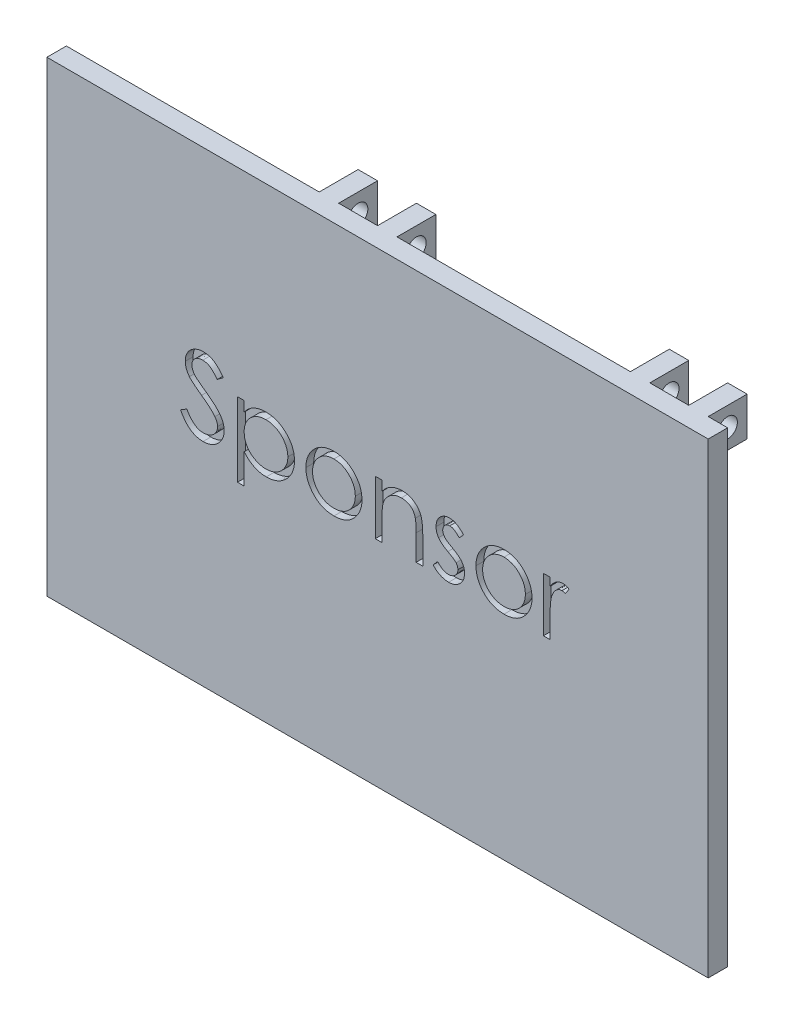
from build123d import *

# Parameters (mm, degrees)
ESQUISSE1_W             = 170
ESQUISSE1_H             = 120
BASE_DEPTH              = 5
ESQUISSE2_W             = 5
ESQUISSE2_H             = 10
BOSS_TIGE_DEPTH         = 10
VIDE_SPONSOR_DEPTH      = 2
ESQUISSE5_R             = 2.5
ENL_V_MAT_EXTRU_3_DEPTH = 176.855054079


with BuildPart() as part:
    # Esquisse1 → BASE (new body)
    with BuildSketch(Plane.XY):
        Rectangle(ESQUISSE1_W, ESQUISSE1_H)
    extrude(amount=BASE_DEPTH)

    # Esquisse2 → BOSS TIGE (add)
    with BuildSketch(Plane(origin=(0, 60, 0), x_dir=(1, 0, 0), z_dir=(0, 1, 0))):
        with Locations((77.5, 5)):
            Rectangle(ESQUISSE2_W, ESQUISSE2_H)
        with Locations((62.5, 5)):
            Rectangle(ESQUISSE2_W, ESQUISSE2_H)
        with Locations((-2.5, 5)):
            Rectangle(ESQUISSE2_W, ESQUISSE2_H)
        with Locations((-17.5, 5)):
            Rectangle(ESQUISSE2_W, ESQUISSE2_H)
    extrude(amount=-BOSS_TIGE_DEPTH)

    # Esquisse4 → VIDE SPONSOR (cut)
    # profile 1 of 7: a face of its own
    with BuildSketch(Plane.XY.offset(5)):
        with BuildLine():
            Line((-50.657804234, -1.320890287), (-49.0474076, -0.355415527))
            add(Edge.make_bspline(
                [(-49.0474076, -0.355415527), (-48.897629765, -0.606137394), (-48.610661215, -1.086510815), (-48.131954532, -1.735615292), (-47.635931115, -2.287315031), (-47.118917743, -2.738400566), (-46.584070225, -3.093540935), (-46.027897018, -3.345013082), (-45.452272363, -3.50185432), (-45.060529134, -3.520904791), (-44.864955676, -3.530415527)],
                knots=[0, 0, 0, 0, 1.272034388, 2.437168799, 3.508375237, 4.49857839, 5.41946034, 6.295179144, 7.148887113, 8, 8, 8, 8], degree=3))
            add(Edge.make_bspline(
                [(-44.864955676, -3.530415527), (-44.697931479, -3.525763667), (-44.366805614, -3.516541342), (-43.87933112, -3.427927263), (-43.405901596, -3.291789818), (-42.956274582, -3.096821605), (-42.536654166, -2.860936419), (-42.168680581, -2.576023653), (-41.850566737, -2.257038447), (-41.590348556, -1.901169998), (-41.390704364, -1.518443804), (-41.237258963, -1.125600411), (-41.152105062, -0.716468633), (-41.13927759, -0.441003113), (-41.132804234, -0.301990046)],
                knots=[0, 0, 0, 0, 1.095163259, 2.171163733, 3.241058638, 4.321873601, 5.38011039, 6.391990106, 7.366004449, 8.327778327, 9.272591725, 10.192022065, 11.087607919, 12, 12, 12, 12], degree=3))
            add(Edge.make_bspline(
                [(-41.132804234, -0.301990046), (-41.140828697, -0.143380564), (-41.157141256, 0.179049335), (-41.295016884, 0.654753161), (-41.511910641, 1.125519863), (-41.712004459, 1.416719609), (-41.815887167, 1.567901781)],
                knots=[0, 0, 0, 0, 0.938893495, 1.908633276, 2.914225137, 4, 4, 4, 4], degree=3))
            add(Edge.make_bspline(
                [(-41.815887167, 1.567901781), (-41.901180081, 1.677013778), (-42.080241886, 1.906080767), (-42.388076347, 2.247049834), (-42.749297626, 2.598758658), (-43.151544118, 2.974637239), (-43.609468502, 3.357203675), (-44.108728259, 3.764701017), (-44.66207012, 4.181632457), (-45.050143094, 4.461245993), (-45.250382359, 4.605521973)],
                knots=[0, 0, 0, 0, 0.722233717, 1.516239348, 2.393582979, 3.351407094, 4.387010283, 5.505090956, 6.712668013, 8, 8, 8, 8], degree=3))
            add(Edge.make_bspline(
                [(-45.250382359, 4.605521973), (-45.45081011, 4.748280428), (-45.834012707, 5.021223724), (-46.369908705, 5.42630447), (-46.849122139, 5.796657532), (-47.269523072, 6.135769369), (-47.630926592, 6.443685975), (-47.936180586, 6.717450472), (-48.177509018, 6.96446671), (-48.311705822, 7.124711728), (-48.371956878, 7.19665779)],
                knots=[0, 0, 0, 0, 1.452282411, 2.77665338, 3.964542531, 5.026858415, 5.96415736, 6.766646006, 7.446254459, 8, 8, 8, 8], degree=3))
            add(Edge.make_bspline(
                [(-48.371956878, 7.19665779), (-48.456171732, 7.308786291), (-48.621791543, 7.529302036), (-48.840409373, 7.87397019), (-49.026223959, 8.226793963), (-49.171887509, 8.588721455), (-49.294548929, 8.954671568), (-49.377051381, 9.329419062), (-49.428711698, 9.7112824), (-49.434002082, 9.968258739), (-49.436650388, 10.096898175)],
                knots=[0, 0, 0, 0, 1.068054152, 2.10047183, 3.106115577, 4.101338837, 5.06977816, 6.043150881, 7.020423561, 8, 8, 8, 8], degree=3))
            add(Edge.make_bspline(
                [(-49.436650388, 10.096898175), (-49.429546322, 10.298445948), (-49.415490034, 10.697233552), (-49.296615219, 11.279787072), (-49.108984183, 11.835973143), (-48.846122008, 12.360285388), (-48.50726413, 12.839071655), (-48.115128184, 13.277839349), (-47.648068523, 13.64669406), (-47.135609245, 13.968976835), (-46.574688134, 14.221231085), (-45.986909074, 14.411518706), (-45.371337868, 14.519337666), (-44.954397949, 14.534810429), (-44.742840292, 14.542661396)],
                knots=[0, 0, 0, 0, 1.005424448, 1.989358655, 2.955360095, 3.929531133, 4.905563448, 5.876582895, 6.856512386, 7.866279853, 8.892233794, 9.918561126, 10.94386622, 12, 12, 12, 12], degree=3))
            add(Edge.make_bspline(
                [(-44.742840292, 14.542661396), (-44.518354546, 14.534918651), (-44.071924046, 14.519520802), (-43.415247601, 14.385639953), (-42.783001416, 14.164112011), (-42.274403075, 13.912713744), (-41.876351902, 13.661627038), (-41.572788885, 13.432919138), (-41.265172474, 13.169620332), (-40.951021347, 12.871029293), (-40.635658615, 12.534406262), (-40.314402397, 12.162056655), (-39.986501448, 11.756255973), (-39.775558838, 11.466562618), (-39.667419619, 11.318052021)],
                knots=[0, 0, 0, 0, 1.286793592, 2.559021753, 3.825965368, 5.121522368, 5.803751409, 6.523245864, 7.299691795, 8.125521123, 9.008227632, 9.944561021, 10.946284179, 12, 12, 12, 12], degree=3))
            Line((-39.667419619, 11.318052021), (-41.212942455, 10.14650755))
            add(Edge.make_bspline(
                [(-41.212942455, 10.14650755), (-41.306265316, 10.266733136), (-41.485983327, 10.498259506), (-41.758830963, 10.822497667), (-42.015998603, 11.118678791), (-42.269365779, 11.375936131), (-42.505551116, 11.608357742), (-42.734788161, 11.807347276), (-42.953777987, 11.974854445), (-43.229822886, 12.15361725), (-43.576629324, 12.330817648), (-44.011973729, 12.480763344), (-44.466921883, 12.570870181), (-44.776781734, 12.582783984), (-44.93364558, 12.588815242)],
                knots=[0, 0, 0, 0, 1.181633172, 2.275549214, 3.290209073, 4.226197932, 5.078386478, 5.862611352, 6.581680152, 7.217281963, 8.414376989, 9.595101626, 10.782541182, 12, 12, 12, 12], degree=3))
            add(Edge.make_bspline(
                [(-44.93364558, 12.588815242), (-45.130440367, 12.582220133), (-45.509940573, 12.569502085), (-46.048730287, 12.43060045), (-46.533655793, 12.211896325), (-46.950320469, 11.905381944), (-47.29723173, 11.542229113), (-47.548177155, 11.124332773), (-47.699217336, 10.662874267), (-47.717648373, 10.340974681), (-47.727035003, 10.177036396)],
                knots=[0, 0, 0, 0, 1.14458467, 2.207223713, 3.21896685, 4.227309161, 5.202851033, 6.127160689, 7.046193047, 8, 8, 8, 8], degree=3))
            add(Edge.make_bspline(
                [(-47.727035003, 10.177036396), (-47.724895271, 10.074974777), (-47.720612308, 9.870684649), (-47.660878052, 9.56887048), (-47.584137419, 9.267818762), (-47.462529666, 8.968882989), (-47.294643085, 8.666835121), (-47.074179199, 8.356473949), (-46.796521029, 8.035063935), (-46.583830433, 7.826018086), (-46.471536205, 7.715648175)],
                knots=[0, 0, 0, 0, 0.858281714, 1.717966888, 2.583508476, 3.4729293, 4.427298488, 5.488583878, 6.674047936, 8, 8, 8, 8], degree=3))
            add(Edge.make_bspline(
                [(-46.471536205, 7.715648175), (-46.42983645, 7.67843522), (-46.330767376, 7.590025758), (-46.149651266, 7.445287773), (-45.910476892, 7.26674697), (-45.619489769, 7.045836004), (-45.271324557, 6.789578332), (-44.865942973, 6.501250528), (-44.407863773, 6.17149253), (-44.082805916, 5.940946488), (-43.910929234, 5.819043608)],
                knots=[0, 0, 0, 0, 0.420754252, 0.999615792, 1.744751191, 2.668019286, 3.750313428, 4.999500688, 6.413464383, 8, 8, 8, 8], degree=3))
            add(Edge.make_bspline(
                [(-43.910929234, 5.819043608), (-43.704177335, 5.668595636), (-43.303830936, 5.377273992), (-42.73419468, 4.939582933), (-42.217701239, 4.511514364), (-41.752537231, 4.09580196), (-41.3341072, 3.695599054), (-40.967053321, 3.306090887), (-40.647635546, 2.930067984), (-40.303760086, 2.447980108), (-39.952381097, 1.855900206), (-39.650620892, 1.130485793), (-39.460347601, 0.402251535), (-39.435465495, -0.08720739), (-39.42318885, -0.328702787)],
                knots=[0, 0, 0, 0, 1.163667725, 2.253281268, 3.268753668, 4.215851969, 5.092017293, 5.902905408, 6.650798638, 7.335211899, 8.59617414, 9.77448103, 10.901945474, 12, 12, 12, 12], degree=3))
            add(Edge.make_bspline(
                [(-39.42318885, -0.328702787), (-39.426765558, -0.499490745), (-39.433849519, -0.837750076), (-39.515279635, -1.334438423), (-39.634585242, -1.816843585), (-39.814402186, -2.27900264), (-40.033875376, -2.729370562), (-40.312365954, -3.156133563), (-40.635169209, -3.568736961), (-41.005467273, -3.956178535), (-41.410665684, -4.311848545), (-41.838929793, -4.628236722), (-42.290960565, -4.892042883), (-42.764305803, -5.107312466), (-43.259074235, -5.275679183), (-43.775099459, -5.397669228), (-44.313232084, -5.472539597), (-44.678994705, -5.480310699), (-44.864955676, -5.484261681)],
                knots=[0, 0, 0, 0, 0.983748083, 1.948392443, 2.894712957, 3.844097841, 4.80183111, 5.778335162, 6.776009319, 7.81870978, 8.863265674, 9.881300176, 10.883814829, 11.87499822, 12.874611388, 13.892143829, 14.928324115, 16, 16, 16, 16], degree=3))
            add(Edge.make_bspline(
                [(-44.864955676, -5.484261681), (-45.008839472, -5.481479392), (-45.294794994, -5.475949856), (-45.717756603, -5.427066029), (-46.13217351, -5.35790308), (-46.532845531, -5.248098499), (-46.924934871, -5.11487381), (-47.306736248, -4.950835171), (-47.678434698, -4.754254403), (-48.042113256, -4.529491483), (-48.396846978, -4.267920045), (-48.739308653, -3.9632643), (-49.080734649, -3.623926623), (-49.411047477, -3.240691985), (-49.736928448, -2.819751848), (-50.051952363, -2.357167864), (-50.362639998, -1.855459696), (-50.557578473, -1.502408301), (-50.657804234, -1.320890287)],
                knots=[0, 0, 0, 0, 0.915332311, 1.819136955, 2.706846663, 3.586547465, 4.459518054, 5.340707479, 6.227863349, 7.133153174, 8.059268498, 9.028702269, 10.047606654, 11.120612155, 12.245963614, 13.433783089, 14.680604001, 16, 16, 16, 16], degree=3))
        make_face()
    # profile 2 of 7: a face of its own
    with BuildSketch(Plane.XY.offset(5)):
        with BuildLine():
            Line((-36.00395808, 8.925353704), (-34.294342696, 8.925353704))
            Line((-34.294342696, 8.925353704), (-34.294342696, 6.34948231))
            add(Edge.make_bspline(
                [(-34.294342696, 6.34948231), (-34.112782675, 6.583186261), (-33.75995711, 7.037343121), (-33.151854413, 7.625117963), (-32.509995639, 8.12082783), (-31.817863351, 8.50935276), (-31.08621441, 8.802291751), (-30.318051368, 9.018805613), (-29.506854662, 9.146394211), (-28.952246826, 9.16175211), (-28.669402792, 9.169584473)],
                knots=[0, 0, 0, 0, 1.0828784, 2.104357462, 3.088488658, 4.04616522, 5.001424249, 5.969181776, 6.964304535, 8, 8, 8, 8], degree=3))
            add(Edge.make_bspline(
                [(-28.669402792, 9.169584473), (-28.42234278, 9.162437028), (-27.934015688, 9.148309727), (-27.215214399, 9.052662102), (-26.523016955, 8.888735804), (-25.861339404, 8.652510822), (-25.223093292, 8.360471764), (-24.617727291, 7.991897613), (-24.035812081, 7.565143918), (-23.491982538, 7.074023211), (-22.989490523, 6.542646504), (-22.554899166, 5.971025106), (-22.18003923, 5.377957314), (-21.877033759, 4.754248926), (-21.639679754, 4.104811404), (-21.470871294, 3.42702089), (-21.370408977, 2.723390414), (-21.356930005, 2.244948464), (-21.350111926, 2.002937838)],
                knots=[0, 0, 0, 0, 1.041296284, 2.058176809, 3.050446431, 4.034000596, 5.01514041, 6.003636468, 7.015969324, 8.052561599, 9.08815499, 10.094063707, 11.074456064, 12.040834395, 13.011057502, 13.983766392, 14.980127149, 16, 16, 16, 16], degree=3))
            add(Edge.make_bspline(
                [(-21.350111926, 2.002937838), (-21.356782069, 1.755819559), (-21.369936554, 1.26846665), (-21.471962943, 0.552801164), (-21.635013929, -0.135651542), (-21.869373469, -0.795746363), (-22.172222141, -1.427028807), (-22.540728391, -2.02904362), (-22.975539019, -2.601597919), (-23.472478014, -3.136918704), (-24.011608995, -3.630037821), (-24.587885045, -4.061319314), (-25.192362911, -4.423494514), (-25.821949992, -4.726024622), (-26.482035968, -4.954037796), (-27.169541093, -5.118508968), (-27.884091062, -5.219933866), (-28.370144475, -5.233280527), (-28.615977311, -5.240030912)],
                knots=[0, 0, 0, 0, 1.038740735, 2.04854663, 3.033179607, 4.009277356, 4.987731542, 5.972001279, 6.972200261, 8.005528982, 9.039189865, 10.040446548, 11.026516639, 11.997840187, 12.972163198, 13.956796175, 14.96660207, 16, 16, 16, 16], degree=3))
            add(Edge.make_bspline(
                [(-28.615977311, -5.240030912), (-28.892624524, -5.232983458), (-29.439083876, -5.219062672), (-30.238082625, -5.077987025), (-31.007032348, -4.867147418), (-31.737413837, -4.558542896), (-32.435012931, -4.165266445), (-33.095883588, -3.685695181), (-33.7235362, -3.120832067), (-34.10131815, -2.692306039), (-34.294342696, -2.473354229)],
                knots=[0, 0, 0, 0, 1.014726462, 2.004382257, 2.969841629, 3.936926163, 4.907207904, 5.903978561, 6.929055279, 8, 8, 8, 8], degree=3))
            Line((-34.294342696, -2.473354229), (-34.294342696, -10.124646296))
            Line((-34.294342696, -10.124646296), (-36.00395808, -10.124646296))
            Line((-36.00395808, -10.124646296), (-36.00395808, 8.925353704))
        make_face()
        with BuildLine():
            add(Edge.make_bspline(
                [(-28.684667215, 7.459969088), (-28.878321691, 7.456484254), (-29.259577438, 7.449623515), (-29.818407659, 7.36812245), (-30.356681344, 7.249807031), (-30.86897368, 7.070672259), (-31.360194892, 6.85078729), (-31.826561561, 6.576020915), (-32.267746321, 6.251343569), (-32.682639158, 5.882974569), (-33.057452227, 5.477075195), (-33.389264735, 5.043890119), (-33.667978781, 4.583967931), (-33.899311205, 4.101592743), (-34.075351073, 3.592983406), (-34.200295776, 3.06103658), (-34.278838125, 2.50517003), (-34.289119341, 2.126586624), (-34.294342696, 1.934247935)],
                knots=[0, 0, 0, 0, 1.05670511, 2.080379991, 3.077984906, 4.06214886, 5.038337365, 6.01289324, 7.01187578, 8.025460281, 9.038092164, 10.024533457, 11.000252242, 11.969694649, 12.940728589, 13.933144304, 14.949937299, 16, 16, 16, 16], degree=3))
            add(Edge.make_bspline(
                [(-34.294342696, 1.934247935), (-34.285683893, 1.681764065), (-34.268720566, 1.187126781), (-34.130812892, 0.464401774), (-33.90637524, -0.219502237), (-33.587811813, -0.858825881), (-33.18532573, -1.446561026), (-32.700377193, -1.972834184), (-32.137354165, -2.434337258), (-31.505617022, -2.823072939), (-30.828405139, -3.1386937), (-30.121998961, -3.364649617), (-29.396112966, -3.503835603), (-28.905339683, -3.521507575), (-28.657954475, -3.530415527)],
                knots=[0, 0, 0, 0, 1.03728447, 2.032128127, 3.01272805, 3.987917167, 4.958271349, 5.931593992, 6.91984656, 7.941419022, 8.973179163, 9.983609215, 10.983593296, 12, 12, 12, 12], degree=3))
            add(Edge.make_bspline(
                [(-28.657954475, -3.530415527), (-28.415552652, -3.52194439), (-27.934428612, -3.505130706), (-27.22599655, -3.35959857), (-26.537526075, -3.137284937), (-25.883402565, -2.81311078), (-25.269320439, -2.415836321), (-24.714793697, -1.939259569), (-24.230341782, -1.386864307), (-23.817422936, -0.77177517), (-23.484692994, -0.112234867), (-23.23470126, 0.570198119), (-23.090418882, 1.273118208), (-23.069971219, 1.746634331), (-23.059727311, 1.98385731)],
                knots=[0, 0, 0, 0, 1.00104056, 1.986885549, 2.97790532, 3.984399681, 4.995088187, 5.994304198, 6.996462723, 8.023150851, 9.048424203, 10.043036403, 11.019596776, 12, 12, 12, 12], degree=3))
            add(Edge.make_bspline(
                [(-23.059727311, 1.98385731), (-23.06764522, 2.22255375), (-23.083419348, 2.698086946), (-23.238796796, 3.398925032), (-23.472295246, 4.084115302), (-23.812795229, 4.73464858), (-24.216662138, 5.348461801), (-24.705142222, 5.890319343), (-25.252781805, 6.364776861), (-25.866132826, 6.756746449), (-26.524394285, 7.068543215), (-27.217351184, 7.296509878), (-27.941488506, 7.433527), (-28.434761883, 7.451077527), (-28.684667215, 7.459969088)],
                knots=[0, 0, 0, 0, 0.983928682, 1.960191568, 2.949917689, 3.96440592, 4.982380491, 5.975291189, 6.965713506, 7.964880129, 8.970154049, 9.96478489, 10.968906225, 12, 12, 12, 12], degree=3))
        make_face(mode=Mode.SUBTRACT)
    # profile 3 of 7: a face of its own
    with BuildSketch(Plane.XY.offset(5)):
        with BuildLine():
            add(Edge.make_bspline(
                [(-11.206902792, 9.169584473), (-10.94569315, 9.164022466), (-10.433524878, 9.153116728), (-9.683456242, 9.036558129), (-8.967474859, 8.858318903), (-8.282838585, 8.611912258), (-7.638315605, 8.28162907), (-7.024517833, 7.887515643), (-6.443128114, 7.420613241), (-6.094659912, 7.059435754), (-5.917780196, 6.876104906)],
                knots=[0, 0, 0, 0, 1.054011418, 2.066658804, 3.057071809, 4.030435133, 4.997543892, 5.974964718, 6.972108034, 8, 8, 8, 8], degree=3))
            add(Edge.make_bspline(
                [(-5.917780196, 6.876104906), (-5.765478417, 6.700768783), (-5.463822319, 6.353489775), (-5.077021764, 5.790395653), (-4.743801558, 5.207247391), (-4.47675887, 4.596301227), (-4.266201813, 3.962890517), (-4.116709952, 3.304838142), (-4.027790349, 2.623597367), (-4.015799914, 2.16093362), (-4.009727311, 1.926615723)],
                knots=[0, 0, 0, 0, 1.025258237, 2.030674902, 3.01204498, 3.988269485, 4.97094183, 5.956517959, 6.965070386, 8, 8, 8, 8], degree=3))
            add(Edge.make_bspline(
                [(-4.009727311, 1.926615723), (-4.01506859, 1.690939695), (-4.025623206, 1.225232872), (-4.125464889, 0.539327467), (-4.280755514, -0.125761497), (-4.502997376, -0.76724953), (-4.787975085, -1.38709749), (-5.13572297, -1.982598037), (-5.548681343, -2.554926077), (-6.016788812, -3.099221797), (-6.534142595, -3.600869337), (-7.095389059, -4.038084633), (-7.689498871, -4.412670358), (-8.32437198, -4.714402849), (-8.99421073, -4.952308504), (-9.700459915, -5.119404307), (-10.442022369, -5.2204329), (-10.948356245, -5.233406349), (-11.206902792, -5.240030912)],
                knots=[0, 0, 0, 0, 0.998656419, 1.973391657, 2.932242238, 3.890759089, 4.846373663, 5.82037756, 6.809684879, 7.83454468, 8.860553229, 9.859544525, 10.845671541, 11.83227036, 12.833544569, 13.85385346, 14.904124723, 16, 16, 16, 16], degree=3))
            add(Edge.make_bspline(
                [(-11.206902792, -5.240030912), (-11.466716051, -5.233384115), (-11.975573445, -5.220366028), (-12.719753432, -5.119796818), (-13.427268358, -4.952385513), (-14.097984015, -4.713621017), (-14.735586682, -4.412660714), (-15.333138902, -4.03921709), (-15.894841299, -3.600739673), (-16.412304528, -3.09925693), (-16.880382652, -2.554917025), (-17.293348597, -1.982600387), (-17.641094515, -1.387096878), (-17.926072739, -0.767249693), (-18.148314464, -0.125761453), (-18.303605125, 0.539327455), (-18.403446799, 1.225232875), (-18.414001416, 1.690939696), (-18.419342696, 1.926615723)],
                knots=[0, 0, 0, 0, 1.099876186, 2.154163076, 3.173186993, 4.173200201, 5.163417411, 6.152872554, 7.150605724, 8.17532212, 9.198891216, 10.186952605, 11.159729845, 12.11414092, 13.071450619, 14.029093627, 15.002601286, 16, 16, 16, 16], degree=3))
            add(Edge.make_bspline(
                [(-18.419342696, 1.926615723), (-18.413228678, 2.159660066), (-18.401123973, 2.621047813), (-18.312293774, 3.301007957), (-18.163385059, 3.957946604), (-17.952575602, 4.588912409), (-17.683071491, 5.197181282), (-17.354533624, 5.781770433), (-16.963787467, 6.342318319), (-16.663331131, 6.689148497), (-16.511289811, 6.864656588)],
                knots=[0, 0, 0, 0, 1.031353054, 2.041901799, 3.029428768, 4.008703097, 4.981709435, 5.96992636, 6.972712378, 8, 8, 8, 8], degree=3))
            add(Edge.make_bspline(
                [(-16.511289811, 6.864656588), (-16.334676766, 7.049577329), (-15.987336135, 7.413256504), (-15.403052346, 7.878797814), (-14.790764548, 8.281112445), (-14.139118879, 8.604832989), (-13.455045037, 8.859768349), (-12.735394589, 9.037017796), (-11.982780712, 9.152696771), (-11.468106203, 9.163899139), (-11.206902792, 9.169584473)],
                knots=[0, 0, 0, 0, 1.027980169, 2.021703884, 2.998553061, 3.971491411, 4.943284454, 5.930300938, 6.949603206, 8, 8, 8, 8], degree=3))
        make_face()
        with BuildLine():
            add(Edge.make_bspline(
                [(-11.214535003, 7.459969088), (-11.399252574, 7.454718954), (-11.76391926, 7.444354216), (-12.300691571, 7.365520392), (-12.817437266, 7.240620405), (-13.315136717, 7.063161185), (-13.792111556, 6.834022892), (-14.248818446, 6.552581674), (-14.686600726, 6.222565154), (-15.096894528, 5.844489756), (-15.47344397, 5.431491228), (-15.802616957, 4.991445161), (-16.082516464, 4.53148919), (-16.315689329, 4.051145012), (-16.489355596, 3.545544874), (-16.615483047, 3.020414581), (-16.694242499, 2.474684243), (-16.704509788, 2.103693557), (-16.709727311, 1.915167406)],
                knots=[0, 0, 0, 0, 1.021534396, 2.016698045, 2.994645724, 3.958388632, 4.93408049, 5.916473867, 6.921342795, 7.962252576, 8.998418191, 10.008913653, 10.997312074, 11.973003931, 12.956656626, 13.948281152, 14.957379055, 16, 16, 16, 16], degree=3))
            add(Edge.make_bspline(
                [(-16.709727311, 1.915167406), (-16.7009816, 1.671588515), (-16.683622998, 1.188129965), (-16.542461211, 0.476143712), (-16.306315887, -0.207380369), (-15.987433694, -0.85843527), (-15.587894132, -1.460808669), (-15.117157383, -1.997863463), (-14.580275586, -2.461517665), (-13.983648635, -2.84622341), (-13.33946299, -3.151892938), (-12.657710728, -3.368513077), (-11.946652093, -3.509329003), (-11.460709828, -3.52332517), (-11.214535003, -3.530415527)],
                knots=[0, 0, 0, 0, 1.016792936, 2.018143844, 3.017858371, 4.030088057, 5.03801393, 6.028138512, 7.003788237, 7.991172063, 8.984598303, 9.972568034, 10.972917682, 12, 12, 12, 12], degree=3))
            add(Edge.make_bspline(
                [(-11.214535003, -3.530415527), (-10.968374338, -3.523283859), (-10.482460023, -3.509206144), (-9.77238936, -3.369222282), (-9.092500456, -3.150943786), (-8.448983904, -2.846567186), (-7.852628534, -2.460056757), (-7.31188546, -2.000481619), (-6.845168019, -1.459386228), (-6.446023684, -0.857637393), (-6.12191927, -0.208389705), (-5.886879272, 0.476269866), (-5.745378126, 1.188097837), (-5.728065329, 1.671577751), (-5.719342696, 1.915167406)],
                knots=[0, 0, 0, 0, 1.02726834, 2.027799167, 3.010890988, 4.004497153, 4.992059811, 5.971914811, 6.958719428, 7.966827853, 8.981595046, 9.981490638, 10.983022906, 12, 12, 12, 12], degree=3))
            add(Edge.make_bspline(
                [(-5.719342696, 1.915167406), (-5.724558423, 2.103694684), (-5.734822177, 2.474687587), (-5.81360734, 3.020401798), (-5.939639634, 3.545591774), (-6.11365658, 4.050971964), (-6.345816284, 4.53273288), (-6.6311134, 4.99009468), (-6.958942267, 5.433015595), (-7.340035454, 5.843154697), (-7.749900982, 6.222712539), (-8.18786069, 6.552709644), (-8.643890359, 6.832785985), (-9.119479502, 7.065121095), (-9.617242763, 7.239005904), (-10.133264423, 7.36624157), (-10.667746517, 7.444021069), (-11.031106452, 7.454619082), (-11.214535003, 7.459969088)],
                knots=[0, 0, 0, 0, 1.042956736, 2.052379634, 3.044323526, 4.02829302, 5.004299113, 5.996692471, 7.007513377, 8.048758398, 9.090003419, 10.095195979, 11.07790575, 12.047570684, 13.018257071, 13.989683339, 14.985167495, 16, 16, 16, 16], degree=3))
        make_face(mode=Mode.SUBTRACT)
    # profile 4 of 7: a face of its own
    with BuildSketch(Plane.XY.offset(5)):
        with BuildLine():
            Line((-0.590496542, 8.925353704), (1.119118843, 8.925353704))
            Line((1.119118843, 8.925353704), (1.119118843, 6.414356108))
            add(Edge.make_bspline(
                [(1.119118843, 6.414356108), (1.3016594, 6.642100071), (1.655885719, 7.084045176), (2.245806162, 7.664910018), (2.869252248, 8.143583314), (3.522406009, 8.52514825), (4.206154107, 8.812784886), (4.916328691, 9.020516597), (5.657181591, 9.145075449), (6.160996598, 9.161350846), (6.41587365, 9.169584473)],
                knots=[0, 0, 0, 0, 1.12780773, 2.188550248, 3.19190651, 4.159438251, 5.104880172, 6.052711206, 7.014878035, 8, 8, 8, 8], degree=3))
            add(Edge.make_bspline(
                [(6.41587365, 9.169584473), (6.67348753, 9.160085624), (7.177700034, 9.141494084), (7.911822053, 8.994446094), (8.597477239, 8.743284062), (9.232220821, 8.399229793), (9.804413225, 7.971385988), (10.306924203, 7.472941204), (10.722558449, 6.899611951), (11.001218382, 6.367718773), (11.184782264, 5.895884049), (11.300346844, 5.491769595), (11.398486901, 5.041546515), (11.483568272, 4.546575324), (11.541137981, 4.003388031), (11.586543882, 3.414211307), (11.619085061, 2.779235997), (11.620376145, 2.34007021), (11.62104192, 2.113604906)],
                knots=[0, 0, 0, 0, 1.235846778, 2.418850247, 3.575807741, 4.728682307, 5.871620074, 6.994088408, 8.11269785, 9.256955736, 9.865816715, 10.540099792, 11.271859618, 12.076849838, 12.949306005, 13.892391288, 14.913166135, 16, 16, 16, 16], degree=3))
            Line((11.62104192, 2.113604906), (11.62104192, -4.995800142))
            Line((11.62104192, -4.995800142), (9.911426535, -4.995800142))
            Line((9.911426535, -4.995800142), (9.911426535, 1.552637358))
            add(Edge.make_bspline(
                [(9.911426535, 1.552637358), (9.910374931, 1.742170951), (9.908363393, 2.104716458), (9.902018944, 2.623796427), (9.886725568, 3.094530518), (9.865235465, 3.515793332), (9.833781028, 3.887180357), (9.801000705, 4.209447992), (9.760914189, 4.482187073), (9.72519319, 4.646371307), (9.709172929, 4.720005146)],
                knots=[0, 0, 0, 0, 1.430800155, 2.736877192, 3.918605307, 4.986035426, 5.920637409, 6.731861385, 7.431261377, 8, 8, 8, 8], degree=3))
            add(Edge.make_bspline(
                [(9.709172929, 4.720005146), (9.651339679, 4.936147453), (9.540028566, 5.35215452), (9.264979315, 5.916439211), (8.917647845, 6.396489347), (8.49366098, 6.789336932), (7.997114154, 7.095066772), (7.429385277, 7.30719644), (6.795952961, 7.439872991), (6.350431249, 7.453083523), (6.1182174, 7.459969088)],
                knots=[0, 0, 0, 0, 1.084156227, 2.086665306, 3.027808233, 3.945421172, 4.874247719, 5.839848303, 6.874090471, 8, 8, 8, 8], degree=3))
            add(Edge.make_bspline(
                [(6.1182174, 7.459969088), (5.980689008, 7.457378263), (5.708523874, 7.452251087), (5.304936169, 7.400809022), (4.91346317, 7.316670856), (4.530176032, 7.203085843), (4.162740755, 7.047081207), (3.799352256, 6.870028492), (3.453694011, 6.649330366), (3.118395521, 6.40336427), (2.806450096, 6.130790299), (2.516191569, 5.843165179), (2.257448915, 5.536865107), (2.023032269, 5.216825393), (1.820676292, 4.878650675), (1.64403877, 4.525603521), (1.494165917, 4.157219254), (1.419692977, 3.901540706), (1.382430141, 3.773610915)],
                knots=[0, 0, 0, 0, 1.023777757, 2.026029729, 3.023749952, 4.003683103, 4.997618607, 5.993177895, 7.010360494, 8.046726602, 9.087585522, 10.09234134, 11.086953743, 12.070360549, 13.043493632, 14.017870808, 15.008233677, 16, 16, 16, 16], degree=3))
            add(Edge.make_bspline(
                [(1.382430141, 3.773610915), (1.360987196, 3.67969331), (1.314307028, 3.475239597), (1.263888864, 3.139717828), (1.218127632, 2.751587821), (1.179826471, 2.311302496), (1.156392704, 1.817320347), (1.130841773, 1.271751001), (1.121539598, 0.672419015), (1.119948357, 0.255160373), (1.119118843, 0.037643367)],
                knots=[0, 0, 0, 0, 0.615963638, 1.340920617, 2.168419149, 3.115676021, 4.16674242, 5.331190069, 6.6087489, 8, 8, 8, 8], degree=3))
            Line((1.119118843, 0.037643367), (1.119118843, -4.995800142))
            Line((1.119118843, -4.995800142), (-0.590496542, -4.995800142))
            Line((-0.590496542, -4.995800142), (-0.590496542, 8.925353704))
        make_face()
    # profile 5 of 7: a face of its own
    with BuildSketch(Plane.XY.offset(5)):
        with BuildLine():
            Line((22.122964997, 7.189025579), (20.962868843, 5.994584473))
            add(Edge.make_bspline(
                [(20.962868843, 5.994584473), (20.862771959, 6.110588884), (20.669796952, 6.334231731), (20.363737034, 6.633246336), (20.058808563, 6.884363104), (19.759185735, 7.096374684), (19.457334299, 7.256662182), (19.156796501, 7.373655645), (18.857261168, 7.446055473), (18.657040033, 7.455386918), (18.558722208, 7.459969088)],
                knots=[0, 0, 0, 0, 1.26578478, 2.440284043, 3.530471711, 4.527705817, 5.468200915, 6.346673037, 7.188140097, 8, 8, 8, 8], degree=3))
            add(Edge.make_bspline(
                [(18.558722208, 7.459969088), (18.438220672, 7.454118708), (18.201090703, 7.442605988), (17.861315892, 7.327688603), (17.545898918, 7.15129247), (17.272901641, 6.901092036), (17.041647269, 6.613903659), (16.872844233, 6.29279509), (16.769615094, 5.947456453), (16.756526481, 5.707808227), (16.749888074, 5.586261156)],
                knots=[0, 0, 0, 0, 0.99966794, 1.967205029, 2.953328237, 3.988086729, 5.028030931, 6.008226631, 6.989793394, 8, 8, 8, 8], degree=3))
            add(Edge.make_bspline(
                [(16.749888074, 5.586261156), (16.755934066, 5.476249887), (16.768009007, 5.256537469), (16.861880219, 4.932426028), (17.011374126, 4.616429863), (17.151093326, 4.422866044), (17.223085189, 4.323130146)],
                knots=[0, 0, 0, 0, 0.960159726, 1.917612774, 2.927026955, 4, 4, 4, 4], degree=3))
            add(Edge.make_bspline(
                [(17.223085189, 4.323130146), (17.266429348, 4.269874051), (17.358681927, 4.156525166), (17.53181113, 3.999205621), (17.727876467, 3.825348512), (17.9636607, 3.651520871), (18.22900558, 3.468468195), (18.529665113, 3.283399443), (18.856097776, 3.082207359), (19.089799402, 2.954602645), (19.211276295, 2.888274377)],
                knots=[0, 0, 0, 0, 0.66740084, 1.420478572, 2.27185888, 3.217733974, 4.268547843, 5.408967954, 6.65319498, 8, 8, 8, 8], degree=3))
            add(Edge.make_bspline(
                [(19.211276295, 2.888274377), (19.359395907, 2.805298549), (19.645514226, 2.645016571), (20.052056287, 2.396225185), (20.421011468, 2.148948433), (20.755505887, 1.905830842), (21.049103447, 1.660070234), (21.31071194, 1.421086585), (21.533806185, 1.181659064), (21.658741129, 1.014383117), (21.718457785, 0.934428223)],
                knots=[0, 0, 0, 0, 1.27191281, 2.456916733, 3.569705269, 4.599008579, 5.553216877, 6.436649441, 7.252746552, 8, 8, 8, 8], degree=3))
            add(Edge.make_bspline(
                [(21.718457785, 0.934428223), (21.817575084, 0.772959944), (22.014836905, 0.4516081), (22.221982613, -0.077537912), (22.342053537, -0.638753647), (22.358720765, -1.022650445), (22.367195766, -1.217855431)],
                knots=[0, 0, 0, 0, 0.995354457, 1.980940102, 2.973342416, 4, 4, 4, 4], degree=3))
            add(Edge.make_bspline(
                [(22.367195766, -1.217855431), (22.363279446, -1.355391784), (22.35556191, -1.626422192), (22.30190586, -2.025573194), (22.209622346, -2.407305572), (22.083926342, -2.775761335), (21.914194256, -3.123880707), (21.715269817, -3.460446576), (21.47646494, -3.778178428), (21.203824739, -4.076659054), (20.90530855, -4.349268622), (20.586867997, -4.588884714), (20.248110933, -4.787953607), (19.891457914, -4.952683557), (19.516098597, -5.083683647), (19.121974294, -5.174375424), (18.710337787, -5.228655738), (18.430412688, -5.236191244), (18.287778699, -5.240030912)],
                knots=[0, 0, 0, 0, 1.032770009, 2.035186124, 3.017557409, 3.978232242, 4.952395191, 5.920591857, 6.910227898, 7.931268572, 8.952309245, 9.941945286, 10.918353717, 11.897095711, 12.887975737, 13.898235213, 14.929059601, 16, 16, 16, 16], degree=3))
            add(Edge.make_bspline(
                [(18.287778699, -5.240030912), (18.095280215, -5.234627786), (17.712957998, -5.223896609), (17.147501099, -5.123170762), (16.594938112, -4.966441546), (16.059450557, -4.750273391), (15.553013851, -4.477310225), (15.08965839, -4.150399197), (14.667774573, -3.780339354), (14.427645112, -3.496696226), (14.307580381, -3.354874662)],
                knots=[0, 0, 0, 0, 1.013940152, 2.01379169, 3.017749504, 4.037548394, 5.051665909, 6.043208538, 7.021604269, 8, 8, 8, 8], degree=3))
            Line((14.307580381, -3.354874662), (15.440963795, -2.065030912))
            add(Edge.make_bspline(
                [(15.440963795, -2.065030912), (15.548582214, -2.181261844), (15.757216792, -2.406593082), (16.090870557, -2.706626993), (16.430392726, -2.958093912), (16.772392949, -3.168424498), (17.121933748, -3.330487764), (17.477056306, -3.444344682), (17.837038299, -3.5175195), (18.078821639, -3.526109865), (18.200008266, -3.530415527)],
                knots=[0, 0, 0, 0, 1.179806542, 2.287233372, 3.337373186, 4.324005949, 5.273901747, 6.200048787, 7.097828587, 8, 8, 8, 8], degree=3))
            add(Edge.make_bspline(
                [(18.200008266, -3.530415527), (18.365024406, -3.522954323), (18.687438262, -3.508376382), (19.14923072, -3.376021924), (19.575616672, -3.168486044), (19.945858024, -2.874110758), (20.261011215, -2.53145257), (20.489220279, -2.145477149), (20.632237748, -1.727512221), (20.649034398, -1.437776402), (20.657580381, -1.29036144)],
                knots=[0, 0, 0, 0, 1.072336372, 2.095165389, 3.102688358, 4.141489647, 5.156069229, 6.117746104, 7.042326257, 8, 8, 8, 8], degree=3))
            add(Edge.make_bspline(
                [(20.657580381, -1.29036144), (20.651667836, -1.168933373), (20.639994308, -0.929189909), (20.548318785, -0.58220591), (20.403468832, -0.253080253), (20.260840674, -0.060459459), (20.188199372, 0.037643367)],
                knots=[0, 0, 0, 0, 1.013901739, 2.00181326, 2.98231254, 4, 4, 4, 4], degree=3))
            add(Edge.make_bspline(
                [(20.188199372, 0.037643367), (20.144534625, 0.086821553), (20.049417036, 0.193949402), (19.874944937, 0.348663045), (19.666037944, 0.515421842), (19.420346486, 0.691398062), (19.137375272, 0.874270471), (18.815977413, 1.06307966), (18.460555834, 1.266793424), (18.209255684, 1.401883263), (18.077892881, 1.472499136)],
                knots=[0, 0, 0, 0, 0.615000592, 1.339693406, 2.178160186, 3.116406724, 4.166410947, 5.330106347, 6.604359322, 8, 8, 8, 8], degree=3))
            add(Edge.make_bspline(
                [(18.077892881, 1.472499136), (17.93612474, 1.551633553), (17.661191072, 1.705100442), (17.271769388, 1.944129393), (16.92044736, 2.187246988), (16.598771376, 2.420815442), (16.314866474, 2.657149436), (16.069851098, 2.896511334), (15.854078737, 3.129247829), (15.734622111, 3.294151687), (15.677562352, 3.37291981)],
                knots=[0, 0, 0, 0, 1.262093308, 2.447601706, 3.550203992, 4.582594899, 5.537233252, 6.418365656, 7.244515135, 8, 8, 8, 8], degree=3))
            add(Edge.make_bspline(
                [(15.677562352, 3.37291981), (15.578880089, 3.531555229), (15.381481075, 3.848881503), (15.189809821, 4.378528526), (15.058059863, 4.936122338), (15.046290283, 5.320860789), (15.040272689, 5.517571252)],
                knots=[0, 0, 0, 0, 0.985009483, 1.970363186, 2.962279964, 4, 4, 4, 4], degree=3))
            add(Edge.make_bspline(
                [(15.040272689, 5.517571252), (15.043180238, 5.646160918), (15.048870723, 5.897829112), (15.094286203, 6.267610406), (15.176972517, 6.618936786), (15.280685739, 6.957084426), (15.424828949, 7.275502967), (15.59707309, 7.57843863), (15.799478931, 7.865472698), (16.032668843, 8.132189746), (16.289063583, 8.37444765), (16.566076544, 8.58562304), (16.857477626, 8.7658162), (17.164500596, 8.916938002), (17.490094884, 9.031245527), (17.831984616, 9.109935009), (18.189477759, 9.162486899), (18.433868173, 9.167184543), (18.558722208, 9.169584473)],
                knots=[0, 0, 0, 0, 1.087655834, 2.128696564, 3.144119009, 4.137814668, 5.115653402, 6.093965665, 7.082169637, 8.081268856, 9.086088321, 10.061021666, 11.022561449, 11.980240094, 12.950172527, 13.934149372, 14.944599409, 16, 16, 16, 16], degree=3))
            add(Edge.make_bspline(
                [(18.558722208, 9.169584473), (18.706724725, 9.163573704), (19.005506132, 9.151439411), (19.453750597, 9.055069867), (19.90133493, 8.896502543), (20.349409164, 8.677502473), (20.794690882, 8.394109906), (21.241096916, 8.051594719), (21.693986338, 7.652210302), (21.976777128, 7.346870232), (22.122964997, 7.189025579)],
                knots=[0, 0, 0, 0, 0.845714091, 1.707292901, 2.609013841, 3.555613372, 4.552488639, 5.621697636, 6.770543573, 8, 8, 8, 8], degree=3))
        make_face()
    # profile 6 of 7: a face of its own
    with BuildSketch(Plane.XY.offset(5)):
        with BuildLine():
            add(Edge.make_bspline(
                [(32.5104049, 9.169584473), (32.771614543, 9.164022466), (33.283782815, 9.153116728), (34.033851451, 9.036558129), (34.749832833, 8.858318903), (35.434469108, 8.611912258), (36.078992087, 8.28162907), (36.692789859, 7.887515643), (37.274179579, 7.420613241), (37.622647781, 7.059435754), (37.799527497, 6.876104906)],
                knots=[0, 0, 0, 0, 1.054011418, 2.066658804, 3.057071809, 4.030435133, 4.997543892, 5.974964718, 6.972108034, 8, 8, 8, 8], degree=3))
            add(Edge.make_bspline(
                [(37.799527497, 6.876104906), (37.951829275, 6.700768783), (38.253485373, 6.353489775), (38.640285928, 5.790395653), (38.973506134, 5.207247391), (39.240548822, 4.596301227), (39.45110588, 3.962890517), (39.600597741, 3.304838142), (39.689517344, 2.623597367), (39.701507778, 2.16093362), (39.707580381, 1.926615723)],
                knots=[0, 0, 0, 0, 1.025258237, 2.030674902, 3.01204498, 3.988269485, 4.97094183, 5.956517959, 6.965070386, 8, 8, 8, 8], degree=3))
            add(Edge.make_bspline(
                [(39.707580381, 1.926615723), (39.702239102, 1.690939695), (39.691684486, 1.225232872), (39.591842803, 0.539327467), (39.436552178, -0.125761497), (39.214310316, -0.76724953), (38.929332607, -1.38709749), (38.581584722, -1.982598037), (38.168626349, -2.554926077), (37.700518881, -3.099221797), (37.183165098, -3.600869337), (36.621918633, -4.038084633), (36.027808821, -4.412670358), (35.392935712, -4.714402849), (34.723096963, -4.952308504), (34.016847778, -5.119404307), (33.275285324, -5.2204329), (32.768951447, -5.233406349), (32.5104049, -5.240030912)],
                knots=[0, 0, 0, 0, 0.998656419, 1.973391657, 2.932242238, 3.890759089, 4.846373663, 5.82037756, 6.809684879, 7.83454468, 8.860553229, 9.859544525, 10.845671541, 11.83227036, 12.833544569, 13.85385346, 14.904124723, 16, 16, 16, 16], degree=3))
            add(Edge.make_bspline(
                [(32.5104049, -5.240030912), (32.250591641, -5.233384115), (31.741734248, -5.220366028), (30.99755426, -5.119796818), (30.290039335, -4.952385513), (29.619323677, -4.713621017), (28.98172101, -4.412660714), (28.384168791, -4.03921709), (27.822466393, -3.600739673), (27.305003164, -3.09925693), (26.836925041, -2.554917025), (26.423959095, -1.982600387), (26.076213177, -1.387096878), (25.791234953, -0.767249693), (25.568993229, -0.125761453), (25.413702567, 0.539327455), (25.313860894, 1.225232875), (25.303306276, 1.690939696), (25.297964997, 1.926615723)],
                knots=[0, 0, 0, 0, 1.099876186, 2.154163076, 3.173186993, 4.173200201, 5.163417411, 6.152872554, 7.150605724, 8.17532212, 9.198891216, 10.186952605, 11.159729845, 12.11414092, 13.071450619, 14.029093627, 15.002601286, 16, 16, 16, 16], degree=3))
            add(Edge.make_bspline(
                [(25.297964997, 1.926615723), (25.304079014, 2.159660066), (25.316183719, 2.621047813), (25.405013918, 3.301007957), (25.553922633, 3.957946604), (25.764732091, 4.588912409), (26.034236201, 5.197181282), (26.362774068, 5.781770433), (26.753520225, 6.342318319), (27.053976562, 6.689148497), (27.206017881, 6.864656588)],
                knots=[0, 0, 0, 0, 1.031353054, 2.041901799, 3.029428768, 4.008703097, 4.981709435, 5.96992636, 6.972712378, 8, 8, 8, 8], degree=3))
            add(Edge.make_bspline(
                [(27.206017881, 6.864656588), (27.382630927, 7.049577329), (27.729971557, 7.413256504), (28.314255347, 7.878797814), (28.926543144, 8.281112445), (29.578188814, 8.604832989), (30.262262655, 8.859768349), (30.981913103, 9.037017796), (31.73452698, 9.152696771), (32.24920149, 9.163899139), (32.5104049, 9.169584473)],
                knots=[0, 0, 0, 0, 1.027980169, 2.021703884, 2.998553061, 3.971491411, 4.943284454, 5.930300938, 6.949603206, 8, 8, 8, 8], degree=3))
        make_face()
        with BuildLine():
            add(Edge.make_bspline(
                [(32.502772689, 7.459969088), (32.318055119, 7.454718954), (31.953388433, 7.444354216), (31.416616122, 7.365520392), (30.899870427, 7.240620405), (30.402170975, 7.063161185), (29.925196137, 6.834022892), (29.468489246, 6.552581674), (29.030706966, 6.222565154), (28.620413164, 5.844489756), (28.243863722, 5.431491228), (27.914690735, 4.991445161), (27.634791228, 4.53148919), (27.401618363, 4.051145012), (27.227952096, 3.545544874), (27.101824645, 3.020414581), (27.023065194, 2.474684243), (27.012797904, 2.103693557), (27.007580381, 1.915167406)],
                knots=[0, 0, 0, 0, 1.021534396, 2.016698045, 2.994645724, 3.958388632, 4.93408049, 5.916473867, 6.921342795, 7.962252576, 8.998418191, 10.008913653, 10.997312074, 11.973003931, 12.956656626, 13.948281152, 14.957379055, 16, 16, 16, 16], degree=3))
            add(Edge.make_bspline(
                [(27.007580381, 1.915167406), (27.016326093, 1.671588515), (27.033684695, 1.188129965), (27.174846482, 0.476143712), (27.410991805, -0.207380369), (27.729873999, -0.85843527), (28.12941356, -1.460808669), (28.600150309, -1.997863463), (29.137032107, -2.461517665), (29.733659058, -2.84622341), (30.377844702, -3.151892938), (31.059596964, -3.368513077), (31.770655599, -3.509329003), (32.256597864, -3.52332517), (32.502772689, -3.530415527)],
                knots=[0, 0, 0, 0, 1.016792936, 2.018143844, 3.017858371, 4.030088057, 5.03801393, 6.028138512, 7.003788237, 7.991172063, 8.984598303, 9.972568034, 10.972917682, 12, 12, 12, 12], degree=3))
            add(Edge.make_bspline(
                [(32.502772689, -3.530415527), (32.748933354, -3.523283859), (33.234847669, -3.509206144), (33.944918332, -3.369222282), (34.624807236, -3.150943786), (35.268323788, -2.846567186), (35.864679158, -2.460056757), (36.405422233, -2.000481619), (36.872139673, -1.459386228), (37.271284009, -0.857637393), (37.595388422, -0.208389705), (37.830428421, 0.476269866), (37.971929567, 1.188097837), (37.989242363, 1.671577751), (37.997964997, 1.915167406)],
                knots=[0, 0, 0, 0, 1.02726834, 2.027799167, 3.010890988, 4.004497153, 4.992059811, 5.971914811, 6.958719428, 7.966827853, 8.981595046, 9.981490638, 10.983022906, 12, 12, 12, 12], degree=3))
            add(Edge.make_bspline(
                [(37.997964997, 1.915167406), (37.99274927, 2.103694684), (37.982485516, 2.474687587), (37.903700352, 3.020401798), (37.777668058, 3.545591774), (37.603651113, 4.050971964), (37.371491409, 4.53273288), (37.086194292, 4.99009468), (36.758365425, 5.433015595), (36.377272238, 5.843154697), (35.96740671, 6.222712539), (35.529447002, 6.552709644), (35.073417333, 6.832785985), (34.597828191, 7.065121095), (34.10006493, 7.239005904), (33.584043269, 7.36624157), (33.049561175, 7.444021069), (32.68620124, 7.454619082), (32.502772689, 7.459969088)],
                knots=[0, 0, 0, 0, 1.042956736, 2.052379634, 3.044323526, 4.02829302, 5.004299113, 5.996692471, 7.007513377, 8.048758398, 9.090003419, 10.095195979, 11.07790575, 12.047570684, 13.018257071, 13.989683339, 14.985167495, 16, 16, 16, 16], degree=3))
        make_face(mode=Mode.SUBTRACT)
    # profile 7 of 7: a face of its own
    with BuildSketch(Plane.XY.offset(5)):
        with BuildLine():
            Line((42.638349612, 8.925353704), (44.347964997, 8.925353704))
            Line((44.347964997, 8.925353704), (44.347964997, 6.876104906))
            add(Edge.make_bspline(
                [(44.347964997, 6.876104906), (44.474178098, 7.066908771), (44.715559673, 7.431819682), (45.116768617, 7.91443402), (45.527722463, 8.314021631), (45.950388554, 8.632447926), (46.387875069, 8.870916473), (46.830580478, 9.045594278), (47.285469821, 9.148885093), (47.591151152, 9.162675437), (47.744299131, 9.169584473)],
                knots=[0, 0, 0, 0, 1.2804753, 2.448899062, 3.506932113, 4.484331642, 5.4025378, 6.288909075, 7.142734305, 8, 8, 8, 8], degree=3))
            add(Edge.make_bspline(
                [(47.744299131, 9.169584473), (47.863096708, 9.163104607), (48.107530443, 9.149771861), (48.477549968, 9.056095801), (48.85878647, 8.90653685), (49.104490035, 8.765892209), (49.232580381, 8.692571252)],
                knots=[0, 0, 0, 0, 0.901110191, 1.854092781, 2.881294221, 4, 4, 4, 4], degree=3))
            Line((49.232580381, 8.692571252), (48.293818362, 7.211922213))
            add(Edge.make_bspline(
                [(48.293818362, 7.211922213), (48.211582118, 7.248608519), (48.055481985, 7.31824615), (47.827129274, 7.400661948), (47.616592284, 7.449190004), (47.482460917, 7.456541766), (47.419930141, 7.459969088)],
                knots=[0, 0, 0, 0, 1.180555205, 2.24091978, 3.179933427, 4, 4, 4, 4], degree=3))
            add(Edge.make_bspline(
                [(47.419930141, 7.459969088), (47.282738934, 7.450824885), (47.00290864, 7.432173361), (46.592057293, 7.285549278), (46.193383218, 7.048647614), (45.87676317, 6.785914848), (45.631604622, 6.532561837), (45.456669966, 6.311318388), (45.296199586, 6.063240408), (45.142873101, 5.792568843), (45.003175128, 5.49468211), (44.872793286, 5.172556334), (44.754907189, 4.825818419), (44.687686574, 4.584250702), (44.653253458, 4.460509954)],
                knots=[0, 0, 0, 0, 1.125678352, 2.296057538, 3.5422874, 4.923748041, 5.663163013, 6.437101912, 7.23742474, 8.08941207, 8.991984279, 9.93940061, 10.944477711, 12, 12, 12, 12], degree=3))
            add(Edge.make_bspline(
                [(44.653253458, 4.460509954), (44.627495717, 4.350144195), (44.570444278, 4.105692425), (44.514973193, 3.695581169), (44.460166246, 3.211038112), (44.421540366, 2.650714514), (44.385737022, 2.01600964), (44.365543575, 1.305956565), (44.348653624, 0.519826468), (44.348201503, -0.029762512), (44.347964997, -0.317254469)],
                knots=[0, 0, 0, 0, 0.566838948, 1.255505196, 2.06880316, 3.007127437, 4.065329342, 5.249902469, 6.561414163, 8, 8, 8, 8], degree=3))
            Line((44.347964997, -0.317254469), (44.347964997, -4.995800142))
            Line((44.347964997, -4.995800142), (42.638349612, -4.995800142))
            Line((42.638349612, -4.995800142), (42.638349612, 8.925353704))
        make_face()
    extrude(amount=-VIDE_SPONSOR_DEPTH, mode=Mode.SUBTRACT)

    # Esquisse5 → Enlèv. mat.-Extru.3 (cut, through all)
    with BuildSketch(Plane(origin=(80, 0, 0), x_dir=(0, 0, -1), z_dir=(1, 0, 0))):
        with Locations((5, 55)):
            Circle(ESQUISSE5_R)
    extrude(amount=-ENL_V_MAT_EXTRU_3_DEPTH, mode=Mode.SUBTRACT)


solid = part.part
